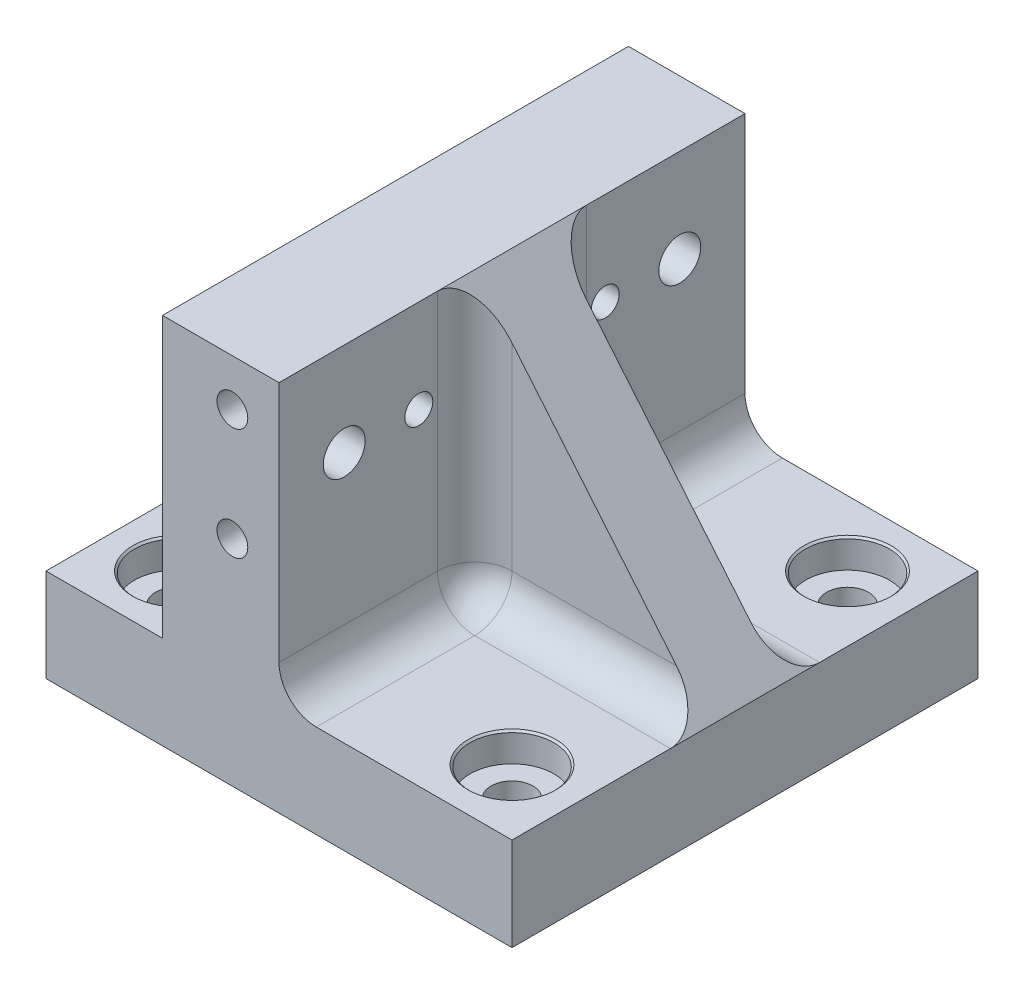
from build123d import *

# Parameters (mm, degrees)
SKIZZE1_W                                    = 50
SKIZZE1_H                                    = 50
AUFSATZ_LINEAR_AUSTRAGEN1_DEPTH              = 40
SKIZZE2_W                                    = 12.5
SKIZZE2_H                                    = 50
SKIZZE2_W_2                                  = 25
SCHNITT_LINEAR_AUSTRAGEN1_DEPTH              = 30
STIRNSENKUNG_F_R_M4_FLACHKOPFSCHRAUB_2_COUNT = 2
STIRNSENKUNG_F_R_M4_FLACHKOPFSCHRAUB_2_PITCH = 36
STIRNSENKUNG_F_R_M4_FLACHKOPFSCHRAUB_3_COUNT = 2
STIRNSENKUNG_F_R_M4_FLACHKOPFSCHRAUB_3_PITCH = 36
STIRNSENKUNG_F_R_M4_FLACHKOPFSCHRAUB_4_COUNT = 2
STIRNSENKUNG_F_R_M4_FLACHKOPFSCHRAUB_4_PITCH = 50.911688245
VERST_RKUNGSRIPPE4_REACH                     = 55.385
SKIZZE7_WALL_W                               = 147.8220309
SKIZZE7_WALL_H                               = 8
VERRUNDUNG1_R                                = 4
DURCHGANGSLOCH_F_R_M41_D                     = 4.5
F_3_0_3_DURCHMESSER_BOHRUNG1_D               = 3
M4_GEWINDEBOHRUNG1_AT_2_COUNT                = 2
M4_GEWINDEBOHRUNG1_AT_2_PITCH                = 12


with BuildPart() as part:
    # Skizze1 → Aufsatz-Linear austragen1 (new body)
    with BuildSketch(Plane(origin=(0, 0, 0), x_dir=(1, 0, 0), z_dir=(0, 1, 0))):
        Rectangle(SKIZZE1_W, SKIZZE1_H)
    extrude(amount=AUFSATZ_LINEAR_AUSTRAGEN1_DEPTH)

    # Skizze2 → Schnitt-Linear austragen1 (cut)
    with BuildSketch(Plane(origin=(0, 40, 0), x_dir=(1, 0, 0), z_dir=(0, 1, 0))):
        with Locations((-18.75, 0)):
            Rectangle(SKIZZE2_W, SKIZZE2_H)
        with Locations((12.5, 0)):
            Rectangle(SKIZZE2_W_2, SKIZZE2_H)
    extrude(amount=-SCHNITT_LINEAR_AUSTRAGEN1_DEPTH, mode=Mode.SUBTRACT)

    # Skizze4 → Stirnsenkung für M4 Flachkopfschraube mit Schlitz1 (revolve, cut)
    with BuildSketch(Plane(origin=(-18, 10, 18), x_dir=(0, 0, 1), z_dir=(1, 0, 0))):
        Polygon((0, 0), (0, 10), (2.25, 10), (2.25, 3.1), (4.5, 3.1), (4.5, 0.2), (4.7, 0), align=None)
    stirnsenkung_f_r_m4_flachkopfschraube_mi = revolve(axis=Axis((-18, 16.35, 18), (0, -1, 0)), mode=Mode.SUBTRACT)

    # Stirnsenkung f_r M4 Flachkopfschraub 2: Stirnsenkung für M4 Flachkopfschraube mit Schlitz1 ×2
    with Locations(*[(0, 0, -i * STIRNSENKUNG_F_R_M4_FLACHKOPFSCHRAUB_2_PITCH) for i in range(1, STIRNSENKUNG_F_R_M4_FLACHKOPFSCHRAUB_2_COUNT)]):
        add(stirnsenkung_f_r_m4_flachkopfschraube_mi, mode=Mode.SUBTRACT)

    # Stirnsenkung f_r M4 Flachkopfschraub 3: Stirnsenkung für M4 Flachkopfschraube mit Schlitz1 ×2
    with Locations(*[(i * STIRNSENKUNG_F_R_M4_FLACHKOPFSCHRAUB_3_PITCH, 0, 0) for i in range(1, STIRNSENKUNG_F_R_M4_FLACHKOPFSCHRAUB_3_COUNT)]):
        add(stirnsenkung_f_r_m4_flachkopfschraube_mi, mode=Mode.SUBTRACT)

    # Stirnsenkung f_r M4 Flachkopfschraub 4: Stirnsenkung für M4 Flachkopfschraube mit Schlitz1 ×2
    with Locations(*[Vector(0.7071067811865476, 0, -0.7071067811865476) * (i * STIRNSENKUNG_F_R_M4_FLACHKOPFSCHRAUB_4_PITCH) for i in range(1, STIRNSENKUNG_F_R_M4_FLACHKOPFSCHRAUB_4_COUNT)]):
        add(stirnsenkung_f_r_m4_flachkopfschraube_mi, mode=Mode.SUBTRACT)

    # Skizze7 wall → Verstärkungsrippe4 (add, up to next)
    with BuildSketch(Plane(origin=(12.5, 25, 0), x_dir=(0.640184399664, -0.768221279597, 0), z_dir=(0.768221279597, 0.640184399664, 0)), mode=Mode.PRIVATE) as verst_rkungsrippe4_sk1:
        Rectangle(SKIZZE7_WALL_W, SKIZZE7_WALL_H)
    verst_rkungsrippe4_tool1 = extrude(verst_rkungsrippe4_sk1.sketch, amount=-VERST_RKUNGSRIPPE4_REACH, mode=Mode.PRIVATE) - part.part
    add(verst_rkungsrippe4_tool1.solids().sort_by_distance((12.5, 25, 0))[0])

    # Verrundung1
    verrundung1_edges = [part.edges().sort_by_distance(p)[0] for p in [
        (0, 10, -14.5),
        (0, 10, 14.5),
        (12.5, 10, -4),
        (12.5, 10, 4),
        (0, 25, 4),
        (0, 25, -4),
    ]]
    fillet(verrundung1_edges, radius=VERRUNDUNG1_R)

    # Durchgangsloch für M41 (through all)
    with Locations(Plane(origin=(0, 0, 0), x_dir=(0, 0, -1), z_dir=(1, 0, 0))):
        with Locations((-18, 30), (18, 30)):
            Hole(DURCHGANGSLOCH_F_R_M41_D / 2)

    # Ø3.0 (3) Durchmesser Bohrung1 (through all)
    with Locations(Plane.ZY.offset(12.5)):
        with Locations((-10, 30), (10, 30)):
            Hole(F_3_0_3_DURCHMESSER_BOHRUNG1_D / 2)

    # Skizze14 → M4 Gewindebohrung1 (revolve, cut)
    with BuildSketch(Plane(origin=(-5, 35, -25), x_dir=(0, 1, 0), z_dir=(1, 0, 0))):
        Polygon((0, 0), (0, 12.491420021), (1.65, 11.5), (1.65, 0), align=None)
    m4_gewindebohrung1 = revolve(axis=Axis((-5, 35, -31.35), (0, 0, 1)), mode=Mode.SUBTRACT)

    # M4 Gewindebohrung1 at 2: M4 Gewindebohrung1 ×2
    with Locations(*[(0, -i * M4_GEWINDEBOHRUNG1_AT_2_PITCH, 0) for i in range(1, M4_GEWINDEBOHRUNG1_AT_2_COUNT)]):
        add(m4_gewindebohrung1, mode=Mode.SUBTRACT)

    # Spiegeln1: M4 Gewindebohrung1 across plane
    add(m4_gewindebohrung1.mirror(Plane.XY), mode=Mode.SUBTRACT)

    # Spiegeln1 copy 1 sketch → Spiegeln1 copy 1 (revolve, cut)
    with BuildSketch(Plane(origin=(-5, 23, 25), x_dir=(0, 1, 0), z_dir=(1, 0, 0))):
        Polygon((0, 0), (0, -12.491420021), (1.65, -11.5), (1.65, 0), align=None)
    revolve(axis=Axis((-5, 23, 31.35), (0, 0, 1)), mode=Mode.SUBTRACT)


solid = part.part
